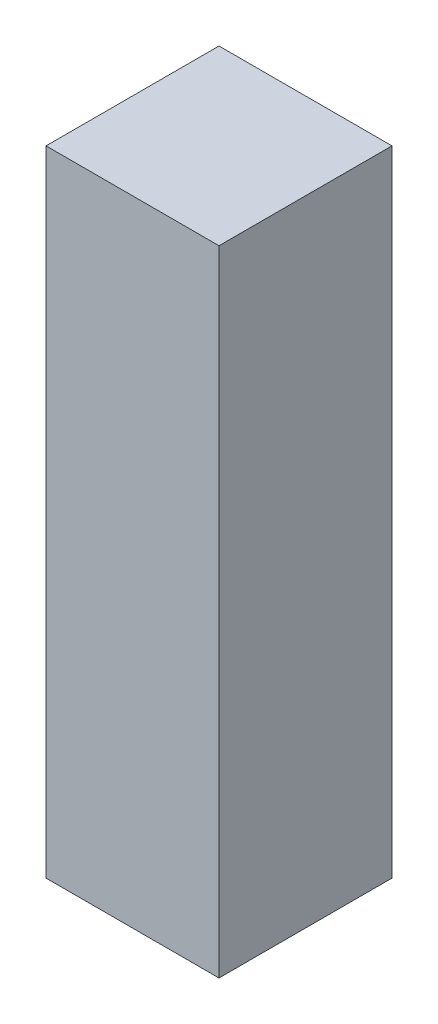
from build123d import *

# Parameters (mm, degrees)
OVEN_KESME_AKTUATOR_24V_1500N_1_START = -270
SKETCH1_W                             = 60
SKETCH1_H                             = 220
OVEN_KESME_AKTUATOR_24V_1500N_1_DEPTH = 60


with BuildPart() as part:
    # Sketch1 → OVEN_kesme_aktuator_24V_1500N_1 (new body)
    with BuildSketch(Plane.XY.offset(OVEN_KESME_AKTUATOR_24V_1500N_1_START)):
        with Locations((350, 670)):
            Rectangle(SKETCH1_W, SKETCH1_H)
    extrude(amount=-OVEN_KESME_AKTUATOR_24V_1500N_1_DEPTH)


solid = part.part
